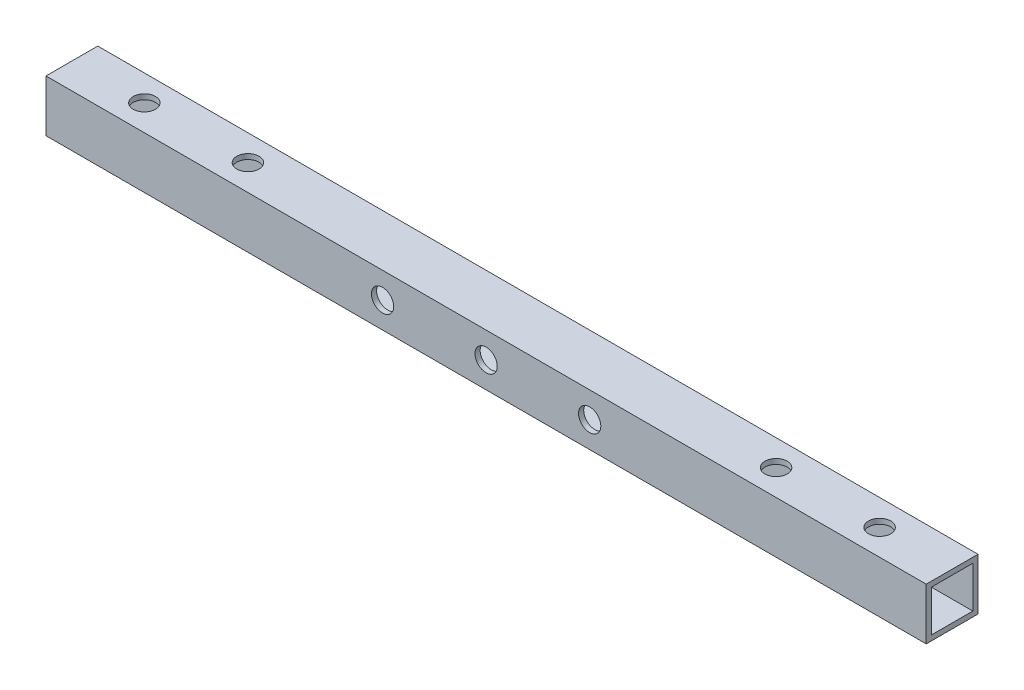
from build123d import *

# Parameters (mm, degrees)
SKETCH_2_W          = 10
SKETCH_2_H          = 10
SKETCH_2_W_2        = 8
SKETCH_2_H_2        = 8
EXTRUDE_1_DEPTH     = 170
CUT_EXTRUDE_1_REACH = 172.587
SKETCH_3_R          = 2.15
SKETCH_4_R          = 2.15
CUT_EXTRUDE_2_DEPTH = 171.587221092


with BuildPart() as part:
    # ｽｹｯﾁ2 → 押し出し-薄板1 (new body)
    with BuildSketch(Plane(origin=(0, 0, 0), x_dir=(0, 0, -1), z_dir=(1, 0, 0))):
        with Locations((5, 5)):
            Rectangle(SKETCH_2_W, SKETCH_2_H)
        with Locations((5, 5)):
            Rectangle(SKETCH_2_W_2, SKETCH_2_H_2, mode=Mode.SUBTRACT)
    extrude(amount=EXTRUDE_1_DEPTH)

    # ｶｯﾄ - 押し出し1: up to this face of the body (flat: up to its plane)
    cut_extrude_1_end = Plane(part.part.faces().sort_by_distance((85, 0, -5))[0])
    # ｽｹｯﾁ3 → ｶｯﾄ - 押し出し1 (cut, up to the picked face)
    with BuildSketch(Plane(origin=(0, 10, 0), x_dir=(1, 0, 0), z_dir=(0, 1, 0)), mode=Mode.PRIVATE) as cut_extrude_1_sk1:
        with Locations(Location((14, 5, 0), (0, 0, 270))):
            Circle(SKETCH_3_R)
    cut_extrude_1_tool1 = split(extrude(cut_extrude_1_sk1.sketch, amount=-CUT_EXTRUDE_1_REACH, mode=Mode.PRIVATE), bisect_by=cut_extrude_1_end, keep=Keep.BOTH, mode=Mode.PRIVATE)
    # ｽｹｯﾁ3 → ｶｯﾄ - 押し出し1 (cut, up to the picked face)
    with BuildSketch(Plane(origin=(0, 10, 0), x_dir=(1, 0, 0), z_dir=(0, 1, 0)), mode=Mode.PRIVATE) as cut_extrude_1_sk2:
        with Locations(Location((34, 5, 0), (0, 0, 270))):
            Circle(SKETCH_3_R)
    cut_extrude_1_tool2 = split(extrude(cut_extrude_1_sk2.sketch, amount=-CUT_EXTRUDE_1_REACH, mode=Mode.PRIVATE), bisect_by=cut_extrude_1_end, keep=Keep.BOTH, mode=Mode.PRIVATE)
    # ｽｹｯﾁ3 → ｶｯﾄ - 押し出し1 (cut, up to the picked face)
    with BuildSketch(Plane(origin=(0, 10, 0), x_dir=(1, 0, 0), z_dir=(0, 1, 0)), mode=Mode.PRIVATE) as cut_extrude_1_sk3:
        with Locations(Location((136, 5, 0), (0, 0, 90))):
            Circle(SKETCH_3_R)
    cut_extrude_1_tool3 = split(extrude(cut_extrude_1_sk3.sketch, amount=-CUT_EXTRUDE_1_REACH, mode=Mode.PRIVATE), bisect_by=cut_extrude_1_end, keep=Keep.BOTH, mode=Mode.PRIVATE)
    # ｽｹｯﾁ3 → ｶｯﾄ - 押し出し1 (cut, up to the picked face)
    with BuildSketch(Plane(origin=(0, 10, 0), x_dir=(1, 0, 0), z_dir=(0, 1, 0)), mode=Mode.PRIVATE) as cut_extrude_1_sk4:
        with Locations(Location((156, 5, 0), (0, 0, 90))):
            Circle(SKETCH_3_R)
    cut_extrude_1_tool4 = split(extrude(cut_extrude_1_sk4.sketch, amount=-CUT_EXTRUDE_1_REACH, mode=Mode.PRIVATE), bisect_by=cut_extrude_1_end, keep=Keep.BOTH, mode=Mode.PRIVATE)
    add(cut_extrude_1_tool1.solids().sort_by(Axis((14, 10, -5), (0, -1, 0)))[0], mode=Mode.SUBTRACT)
    add(cut_extrude_1_tool2.solids().sort_by(Axis((34, 10, -5), (0, -1, 0)))[0], mode=Mode.SUBTRACT)
    add(cut_extrude_1_tool3.solids().sort_by(Axis((136, 10, -5), (0, -1, 0)))[0], mode=Mode.SUBTRACT)
    add(cut_extrude_1_tool4.solids().sort_by(Axis((156, 10, -5), (0, -1, 0)))[0], mode=Mode.SUBTRACT)

    # ｽｹｯﾁ4 → ｶｯﾄ - 押し出し2 (cut, through all)
    with BuildSketch(Plane.XY):
        with Locations((105, 5)):
            Circle(SKETCH_4_R)
        with Locations((85, 5)):
            Circle(SKETCH_4_R)
        with Locations((65, 5)):
            Circle(SKETCH_4_R)
    extrude(amount=-CUT_EXTRUDE_2_DEPTH, mode=Mode.SUBTRACT)


solid = part.part
